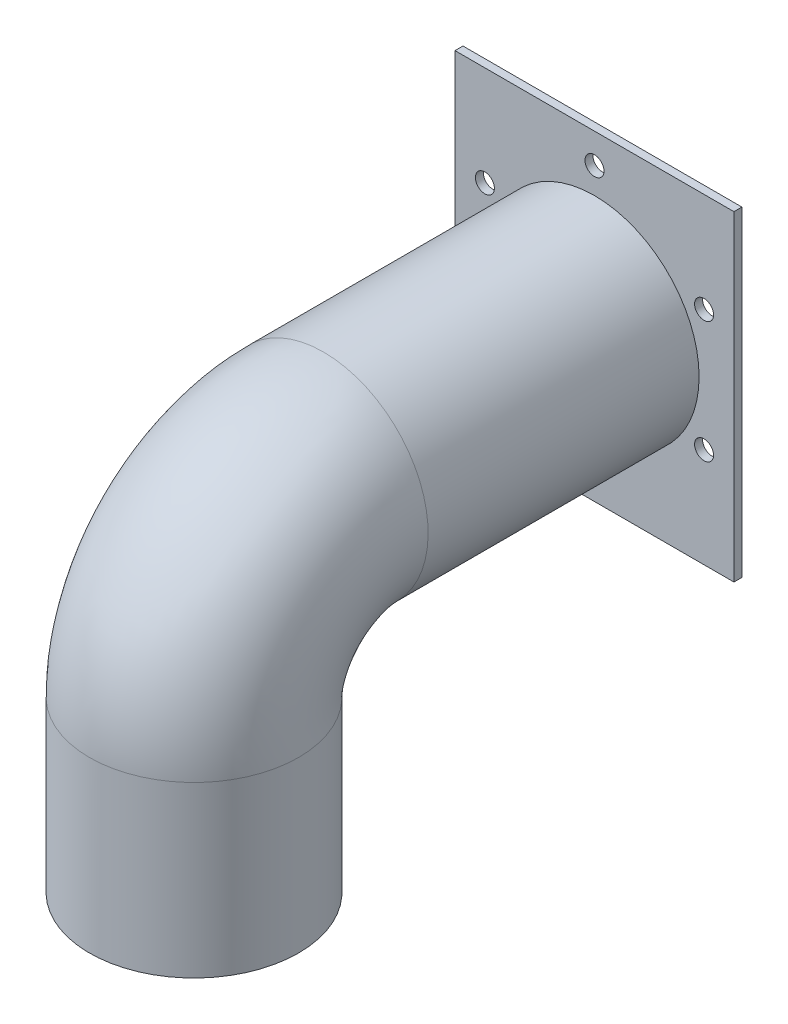
from build123d import *

# Parameters (mm, degrees)
CROQUIS1_R              = 105
SALIENTE_EXTRUIR1_DEPTH = 10
CROQUIS2_R              = 105
CROQUIS3_W              = 280
CROQUIS3_H              = 322
SALIENTE_EXTRUIR2_DEPTH = 8
CROQUIS6_R              = 9.525
CORTAR_EXTRUIR1_DEPTH   = 10


with BuildPart() as part:
    # Croquis1 → Saliente-Extruir1 (new body)
    with BuildSketch(Plane.XY):
        Circle(CROQUIS1_R)
    extrude(amount=SALIENTE_EXTRUIR1_DEPTH)

    # Barrer1: sweep along a curve in space
    with BuildLine() as barrer1_path:
        Line((0, 0, 10), (0, 0, 280))
        ThreePointArc((0, 0, 280), (0, -38.076118446, 371.923881554), (0, -130, 410))
        Line((0, -130, 410), (0, -300, 410))
    # Croquis2 → Barrer1 (sweep)
    with BuildSketch(Plane.XY.offset(10)):
        Circle(CROQUIS2_R)
    sweep(path=barrer1_path.line)

    # Croquis3 → Saliente-Extruir2 (add)
    with BuildSketch(Plane(origin=(0, 0, 0), x_dir=(-1, 0, 0), z_dir=(0, 0, -1))):
        Rectangle(CROQUIS3_W, CROQUIS3_H)
    extrude(amount=-SALIENTE_EXTRUIR2_DEPTH)

    # Croquis6 → Cortar-Extruir1 (cut)
    with BuildSketch(Plane(origin=(0, 0, 0), x_dir=(-1, 0, 0), z_dir=(0, 0, -1))):
        with Locations((0, 131)):
            Circle(CROQUIS6_R)
        with Locations((-110, 61)):
            Circle(CROQUIS6_R)
        with Locations(Location((110, 61, 0), (0, 0, 180))):
            Circle(CROQUIS6_R)
        with Locations((110, -61)):
            Circle(CROQUIS6_R)
        with Locations(Location((-110, -61, 0), (0, 0, 180))):
            Circle(CROQUIS6_R)
        with Locations(Location((0, -131, 0), (0, 0, 180))):
            Circle(CROQUIS6_R)
    extrude(amount=-CORTAR_EXTRUIR1_DEPTH, mode=Mode.SUBTRACT)


solid = part.part
